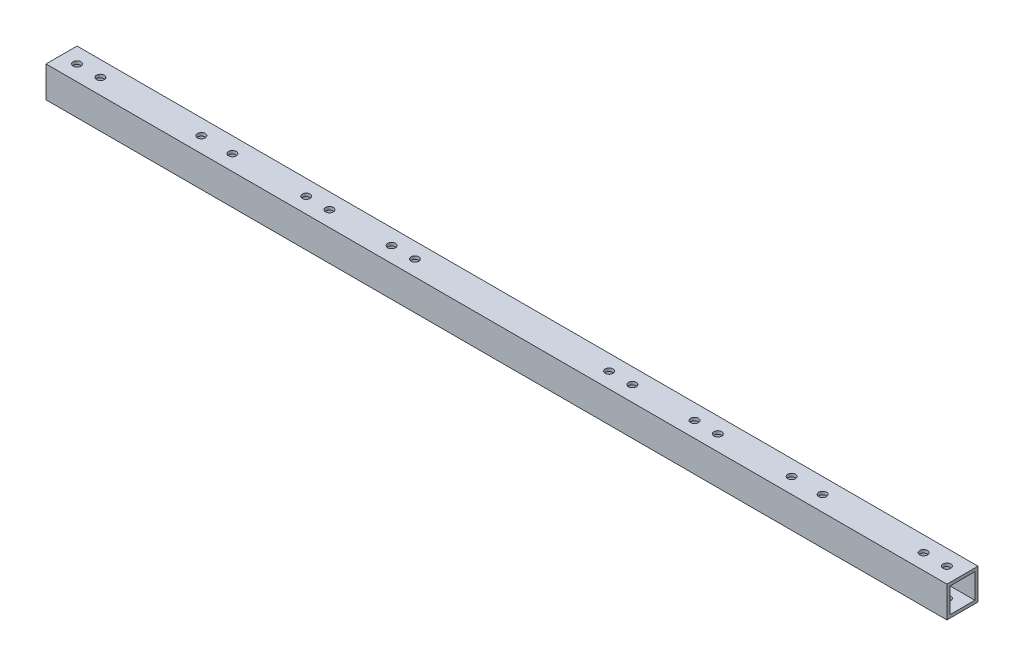
from build123d import *

# Parameters (mm, degrees)
SKETCH1_W           = 20
SKETCH1_H           = 20
SKETCH1_W_2         = 16
SKETCH1_H_2         = 16
BOSS_EXTRUDE1_DEPTH = 580
SKETCH2_R           = 2.5
CUT_EXTRUDE1_DEPTH  = 581.430874437
SKETCH3_R           = 2.5
CUT_EXTRUDE2_DEPTH  = 581.430874437
SKETCH4_R           = 2.5
CUT_EXTRUDE3_DEPTH  = 581.430874437


with BuildPart() as part:
    # Sketch1 → Boss-Extrude1 (new body)
    with BuildSketch(Plane(origin=(0, 0, 0), x_dir=(0, 0, -1), z_dir=(1, 0, 0))):
        Rectangle(SKETCH1_W, SKETCH1_H)
        Rectangle(SKETCH1_W_2, SKETCH1_H_2, mode=Mode.SUBTRACT)
    extrude(amount=BOSS_EXTRUDE1_DEPTH)

    # Sketch2 → Cut-Extrude1 (cut, through all)
    with BuildSketch(Plane(origin=(0, 10, 0), x_dir=(1, 0, 0), z_dir=(0, 1, 0))):
        with Locations(Location((10, 0, 0), (0, 0, 270))):
            Circle(SKETCH2_R)
        with Locations(Location((570, 0, 0), (0, 0, 270))):
            Circle(SKETCH2_R)
        with Locations(Location((25, 0, 0), (0, 0, 270))):
            Circle(SKETCH2_R)
        with Locations(Location((555, 0, 0), (0, 0, 270))):
            Circle(SKETCH2_R)
    extrude(amount=-CUT_EXTRUDE1_DEPTH, mode=Mode.SUBTRACT)

    # Sketch3 → Cut-Extrude2 (cut, through all)
    with BuildSketch(Plane(origin=(0, 10, 0), x_dir=(1, 0, 0), z_dir=(0, 1, 0))):
        with Locations(Location((110, 0, 0), (0, 0, 270))):
            Circle(SKETCH3_R)
        with Locations(Location((90, 0, 0), (0, 0, 270))):
            Circle(SKETCH3_R)
        with Locations(Location((490, 0, 0), (0, 0, 270))):
            Circle(SKETCH3_R)
        with Locations(Location((470, 0, 0), (0, 0, 270))):
            Circle(SKETCH3_R)
    extrude(amount=-CUT_EXTRUDE2_DEPTH, mode=Mode.SUBTRACT)

    # Sketch4 → Cut-Extrude3 (cut, through all)
    with BuildSketch(Plane(origin=(0, 10, 0), x_dir=(1, 0, 0), z_dir=(0, 1, 0))):
        with Locations(Location((157.5, 0, 0), (0, 0, 270))):
            Circle(SKETCH4_R)
        with Locations(Location((172.5, 0, 0), (0, 0, 270))):
            Circle(SKETCH4_R)
        with Locations(Location((212.5, 0, 0), (0, 0, 270))):
            Circle(SKETCH4_R)
        with Locations(Location((227.5, 0, 0), (0, 0, 270))):
            Circle(SKETCH4_R)
        with Locations(Location((352.5, 0, 0), (0, 0, 270))):
            Circle(SKETCH4_R)
        with Locations(Location((367.5, 0, 0), (0, 0, 270))):
            Circle(SKETCH4_R)
        with Locations(Location((407.5, 0, 0), (0, 0, 270))):
            Circle(SKETCH4_R)
        with Locations(Location((422.5, 0, 0), (0, 0, 270))):
            Circle(SKETCH4_R)
    extrude(amount=-CUT_EXTRUDE3_DEPTH, mode=Mode.SUBTRACT)


solid = part.part
